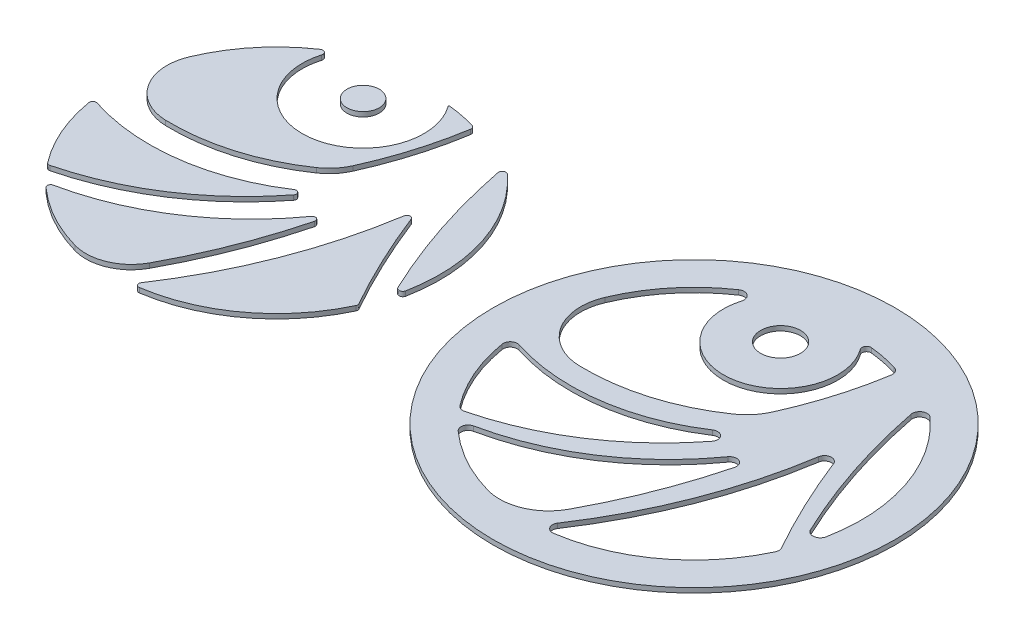
from build123d import *

# Parameters (mm, degrees)
SKETCH1_R             = 21.304347825
SKETCH1_R_2           = 2.112216788
BOSS_EXTRUDE1_DEPTH   = 0.5
SKETCH1_R_3           = 1.712216788
BOSS_EXTRUDE1_2_DEPTH = 0.5
BOSS_EXTRUDE1_3_DEPTH = 0.5
BOSS_EXTRUDE1_4_DEPTH = 0.5
BOSS_EXTRUDE1_5_DEPTH = 0.5
BOSS_EXTRUDE1_6_DEPTH = 0.5
BOSS_EXTRUDE1_7_DEPTH = 0.5


with BuildPart() as part:
    # Sketch1 → Boss-Extrude1 (new body)
    with BuildSketch(Plane(origin=(0, 0, 0), x_dir=(1, 0, 0), z_dir=(0, 1, 0))):
        with Locations(Location((44.487062997, -0.21741061, 0), (0, 0, 90))):
            Circle(SKETCH1_R)
        with Locations(Location((41.558946189, 11.881816638, 0), (0, 0, 270))):
            Circle(SKETCH1_R_2, mode=Mode.SUBTRACT)
        with BuildLine():
            ThreePointArc((39.673526788, -17.26792982), (43.131364778, -17.051633854), (45.695197803, -14.721357534))
            ThreePointArc((45.695197803, -14.721357534), (48.558363163, -8.54854891), (50.646909198, -2.072496282))
            ThreePointArc((50.646909198, -2.072496282), (50.238084471, -1.209442528), (49.314698472, -1.453076963))
            ThreePointArc((49.314698472, -1.453076963), (42.161553817, -8.3207717), (33.000497038, -12.116525664))
            ThreePointArc((33.000497038, -12.116525664), (32.432151651, -12.654100691), (32.654790326, -13.404057629))
            ThreePointArc((32.654790326, -13.404057629), (35.942876939, -15.737952507), (39.673526788, -17.26792982))
        make_face(mode=Mode.SUBTRACT)
        with BuildLine():
            ThreePointArc((56.423543694, 12.874982783), (61.307004643, 5.348548355), (61.877086439, -3.605244851))
            ThreePointArc((61.877086439, -3.605244851), (61.205780047, -4.233397155), (60.399042663, -3.792486299))
            ThreePointArc((60.399042663, -3.792486299), (57.264233589, 4.010737662), (55.125564527, 12.143598583))
            ThreePointArc((55.125564527, 12.143598583), (55.510050475, 12.978702256), (56.423543694, 12.874982783))
        make_face(mode=Mode.SUBTRACT)
        with BuildLine():
            ThreePointArc((35.74306904, 13.58123778), (42.584701249, 5.910193259), (46.474366925, 15.424569553))
            ThreePointArc((46.474366925, 15.424569553), (46.449049576, 15.935533661), (46.905099323, 16.167361001))
            ThreePointArc((46.905099323, 16.167361001), (48.425339038, 15.936857925), (49.918144326, 15.568357139))
            ThreePointArc((49.918144326, 15.568357139), (50.359254089, 15.234200839), (50.469975713, 14.692002558))
            ThreePointArc((50.469975713, 14.692002558), (49.341079976, 9.758502022), (47.573967467, 5.016018864))
            ThreePointArc((47.573967467, 5.016018864), (46.778881813, 3.745551568), (45.670393621, 2.736838391))
            ThreePointArc((45.670393621, 2.736838391), (39.668336878, -0.122026225), (33.076504218, -0.985469451))
            ThreePointArc((33.076504218, -0.985469451), (28.602377258, 1.530626264), (28.152690377, 6.64397462))
            ThreePointArc((28.152690377, 6.64397462), (30.783805242, 11.012507603), (34.550280043, 14.450604958))
            ThreePointArc((34.550280043, 14.450604958), (35.452186805, 14.435090248), (35.74306904, 13.58123778))
        make_face(mode=Mode.SUBTRACT)
        with BuildLine():
            ThreePointArc((46.04448921, 0.18947378), (47.003905166, 0.072394105), (47.045268493, -0.89325371))
            ThreePointArc((47.045268493, -0.89325371), (39.985712078, -7.399346097), (31.193373212, -11.254388531))
            ThreePointArc((31.193373212, -11.254388531), (30.764585044, -11.23560468), (30.416859282, -10.984011912))
            ThreePointArc((30.416859282, -10.984011912), (28.223590637, -7.245198523), (27.003836731, -3.085708973))
            ThreePointArc((27.003836731, -3.085708973), (27.254060539, -2.398116018), (27.971395863, -2.253803647))
            ThreePointArc((27.971395863, -2.253803647), (37.285921037, -3.088391272), (46.04448921, 0.18947378))
        make_face(mode=Mode.SUBTRACT)
        with BuildLine():
            ThreePointArc((55.550587305, 3.507035985), (54.772891569, 3.976842729), (54.116521674, 3.348585143))
            ThreePointArc((54.116521674, 3.348585143), (51.330970772, -7.038880469), (46.380123031, -16.586018381))
            ThreePointArc((46.380123031, -16.586018381), (46.371937467, -17.400676251), (47.113228794, -17.73864314))
            ThreePointArc((47.113228794, -17.73864314), (55.103018102, -14.401621317), (60.557195292, -7.676712468))
            ThreePointArc((60.557195292, -7.676712468), (60.626099076, -7.33330644), (60.530956972, -6.996225721))
            ThreePointArc((60.530956972, -6.996225721), (57.859832456, -1.830391693), (55.550587305, 3.507035985))
        make_face(mode=Mode.SUBTRACT)
    extrude(amount=BOSS_EXTRUDE1_DEPTH)


with BuildPart() as body_2:
    # Sketch1 → Boss-Extrude1 2 (new body)
    with BuildSketch(Plane(origin=(0, 0, 0), x_dir=(1, 0, 0), z_dir=(0, 1, 0))):
        with Locations(Location((-2.928116808, 12.099227248, 0), (0, 0, 270))):
            Circle(SKETCH1_R_3)
    extrude(amount=BOSS_EXTRUDE1_2_DEPTH)


with BuildPart() as body_3:
    # Sketch1 → Boss-Extrude1 3 (new body)
    with BuildSketch(Plane(origin=(0, 0, 0), x_dir=(1, 0, 0), z_dir=(0, 1, 0))):
        with BuildLine():
            ThreePointArc((-11.399803254, -0.368203468), (-15.548599028, 1.964937134), (-15.965587426, 6.706474028))
            ThreePointArc((-15.965587426, 6.706474028), (-13.393875896, 10.976377555), (-9.712437733, 14.336852131))
            ThreePointArc((-9.712437733, 14.336852131), (-9.270478736, 14.329249499), (-9.12793848, 13.910838421))
            ThreePointArc((-9.12793848, 13.910838421), (-1.834644871, 5.733377507), (2.311803366, 15.875860718))
            ThreePointArc((2.311803366, 15.875860718), (2.30801657, 15.952287238), (2.376229375, 15.986962387))
            ThreePointArc((2.376229375, 15.986962387), (3.860281002, 15.761946252), (5.317551256, 15.402217331))
            ThreePointArc((5.317551256, 15.402217331), (5.533707112, 15.2384716), (5.587963738, 14.972779603))
            ThreePointArc((5.587963738, 14.972779603), (4.470812566, 10.090605171), (2.722084367, 5.397460851))
            ThreePointArc((2.722084367, 5.397460851), (1.984812486, 4.219374177), (0.956926784, 3.284008461))
            ThreePointArc((0.956926784, 3.284008461), (-4.932103401, 0.478979995), (-11.399803254, -0.368203468))
        make_face()
    extrude(amount=BOSS_EXTRUDE1_3_DEPTH)


with BuildPart() as body_4:
    # Sketch1 → Boss-Extrude1 4 (new body)
    with BuildSketch(Plane(origin=(0, 0, 0), x_dir=(1, 0, 0), z_dir=(0, 1, 0))):
        with BuildLine():
            ThreePointArc((1.777253093, 0.072704584), (-7.147553962, -3.267374817), (-16.638870162, -2.4169466))
            ThreePointArc((-16.638870162, -2.4169466), (-16.972221986, -2.484009785), (-17.088503117, -2.803540078))
            ThreePointArc((-17.088503117, -2.803540078), (-15.896287899, -6.869119797), (-13.752537225, -10.523521066))
            ThreePointArc((-13.752537225, -10.523521066), (-13.590946107, -10.640438364), (-13.3916846, -10.64916738))
            ThreePointArc((-13.3916846, -10.64916738), (-4.720197899, -6.847113147), (2.242323735, -0.430448086))
            ThreePointArc((2.242323735, -0.430448086), (2.223101845, 0.018296664), (1.777253093, 0.072704584))
        make_face()
    extrude(amount=BOSS_EXTRUDE1_4_DEPTH)


with BuildPart() as body_5:
    # Sketch1 → Boss-Extrude1 5 (new body)
    with BuildSketch(Plane(origin=(0, 0, 0), x_dir=(1, 0, 0), z_dir=(0, 1, 0))):
        with BuildLine():
            ThreePointArc((5.153271658, -1.467961589), (-2.106660176, -8.438182107), (-11.404479659, -12.290601758))
            ThreePointArc((-11.404479659, -12.290601758), (-11.668594592, -12.540417444), (-11.565132507, -12.888928809))
            ThreePointArc((-11.565132507, -12.888928809), (-8.351281844, -15.170130761), (-4.704859805, -16.665565396))
            ThreePointArc((-4.704859805, -16.665565396), (-1.511499324, -16.465813125), (0.856235395, -14.313771205))
            ThreePointArc((0.856235395, -14.313771205), (3.698824612, -8.185323479), (5.772361309, -1.755811013))
            ThreePointArc((5.772361309, -1.755811013), (5.582376982, -1.354742596), (5.153271658, -1.467961589))
        make_face()
    extrude(amount=BOSS_EXTRUDE1_5_DEPTH)


with BuildPart() as body_6:
    # Sketch1 → Boss-Extrude1 6 (new body)
    with BuildSketch(Plane(origin=(0, 0, 0), x_dir=(1, 0, 0), z_dir=(0, 1, 0))):
        with BuildLine():
            ThreePointArc((10.024736828, 3.504716203), (7.216810324, -6.966189204), (2.226193717, -16.590016779))
            ThreePointArc((2.226193717, -16.590016779), (2.222389816, -16.968595218), (2.566874198, -17.125651304))
            ThreePointArc((2.566874198, -17.125651304), (10.376276046, -13.863970253), (15.70731292, -7.290891344))
            ThreePointArc((15.70731292, -7.290891344), (15.739333094, -7.131307643), (15.69511975, -6.974663367))
            ThreePointArc((15.69511975, -6.974663367), (13.011342786, -1.784360079), (10.691159319, 3.578349656))
            ThreePointArc((10.691159319, 3.578349656), (10.329757499, 3.796672844), (10.024736828, 3.504716203))
        make_face()
    extrude(amount=BOSS_EXTRUDE1_6_DEPTH)


with BuildPart() as body_7:
    # Sketch1 → Boss-Extrude1 7 (new body)
    with BuildSketch(Plane(origin=(0, 0, 0), x_dir=(1, 0, 0), z_dir=(0, 1, 0))):
        with BuildLine():
            ThreePointArc((11.030942488, 12.438404895), (13.156918599, 4.353812312), (16.273122655, -3.403099698))
            ThreePointArc((16.273122655, -3.403099698), (16.668446052, -3.619158085), (16.997404557, -3.311346265))
            ThreePointArc((16.997404557, -3.311346265), (16.440193639, 5.440294925), (11.666987802, 12.79680317))
            ThreePointArc((11.666987802, 12.79680317), (11.219351125, 12.84762855), (11.030942488, 12.438404895))
        make_face()
    extrude(amount=BOSS_EXTRUDE1_7_DEPTH)


solid = Compound([part.part, body_2.part, body_3.part, body_4.part, body_5.part, body_6.part, body_7.part])
